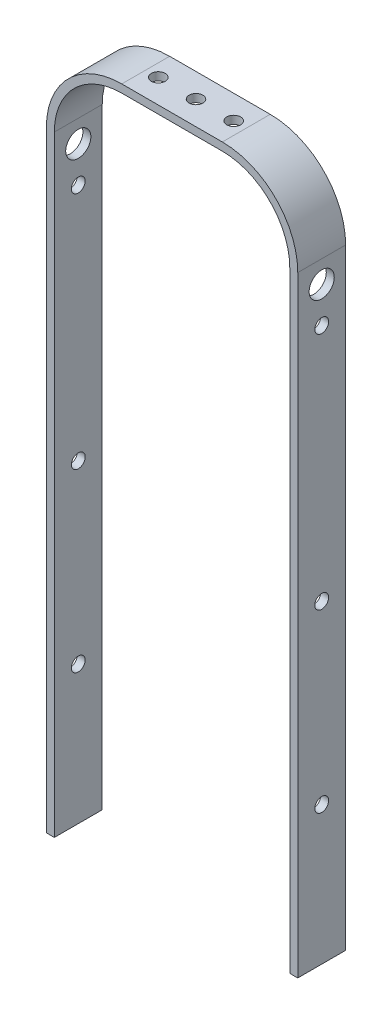
from build123d import *

# Parameters (mm, degrees)
BOSS_EXTRUDE1_DEPTH     = 9.525
SKETCH12_R              = 2.75
CUT_EXTRUDE2_DEPTH      = 278.704385318
CUT_EXTRUDE3_DEPTH      = 291.894698516
CUT_EXTRUDE3_DEPTH_BACK = 291.894698516
SKETCH13_R              = 2.75
SKETCH14_R              = 5
CUT_EXTRUDE4_DEPTH      = 291.894698516


with BuildPart() as part:
    # Sketch1 → Boss-Extrude1 (new, symmetric)
    with BuildSketch(Plane.XY):
        with BuildLine():
            Line((50, 0), (50, 243))
            ThreePointArc((50, 243), (41.213203436, 264.213203436), (20, 273))
            Line((20, 273), (-20, 273))
            ThreePointArc((-20, 273), (-41.213203436, 264.213203436), (-50, 243))
            Line((-50, 243), (-50, 0))
            Line((-50, 0), (-46.825, 0))
            Line((-46.825, 0), (-46.825, 243))
            ThreePointArc((-46.825, 243), (-38.968139405, 261.968139405), (-20, 269.825))
            Line((-20, 269.825), (20, 269.825))
            ThreePointArc((20, 269.825), (38.968139405, 261.968139405), (46.825, 243))
            Line((46.825, 243), (46.825, 0))
            Line((46.825, 0), (50, 0))
        make_face()
    extrude(amount=BOSS_EXTRUDE1_DEPTH, both=True)

    # Sketch12 → Cut-Extrude2 (cut, through all)
    with BuildSketch(Plane(origin=(0, 273, 0), x_dir=(1, 0, 0), z_dir=(0, 1, 0))):
        with Locations(Location((0, 0, 0), (0, 0, 270))):
            Circle(SKETCH12_R)
        with Locations(Location((-15, 0, 0), (0, 0, 270))):
            Circle(SKETCH12_R)
        with Locations(Location((15, 0, 0), (0, 0, 270))):
            Circle(SKETCH12_R)
    extrude(amount=-CUT_EXTRUDE2_DEPTH, mode=Mode.SUBTRACT)

    # Sketch13 → Cut-Extrude3 (cut, two sides: drawn at the far end of the back side and taken through both)
    with BuildSketch(Plane(origin=(50, 0, 0), x_dir=(0, 0, -1), z_dir=(1, 0, 0)).offset(-CUT_EXTRUDE3_DEPTH_BACK)):
        with Locations((0, 220)):
            Circle(SKETCH13_R)
        with Locations((0, 125)):
            Circle(SKETCH13_R)
        with Locations((0, 55)):
            Circle(SKETCH13_R)
    extrude(amount=CUT_EXTRUDE3_DEPTH + CUT_EXTRUDE3_DEPTH_BACK, mode=Mode.SUBTRACT)

    # Sketch14 → Cut-Extrude4 (cut, through all)
    with BuildSketch(Plane(origin=(50, 0, 0), x_dir=(0, 0, -1), z_dir=(1, 0, 0))):
        with Locations((0, 234.175)):
            Circle(SKETCH14_R)
    extrude(amount=-CUT_EXTRUDE4_DEPTH, mode=Mode.SUBTRACT)


solid = part.part
